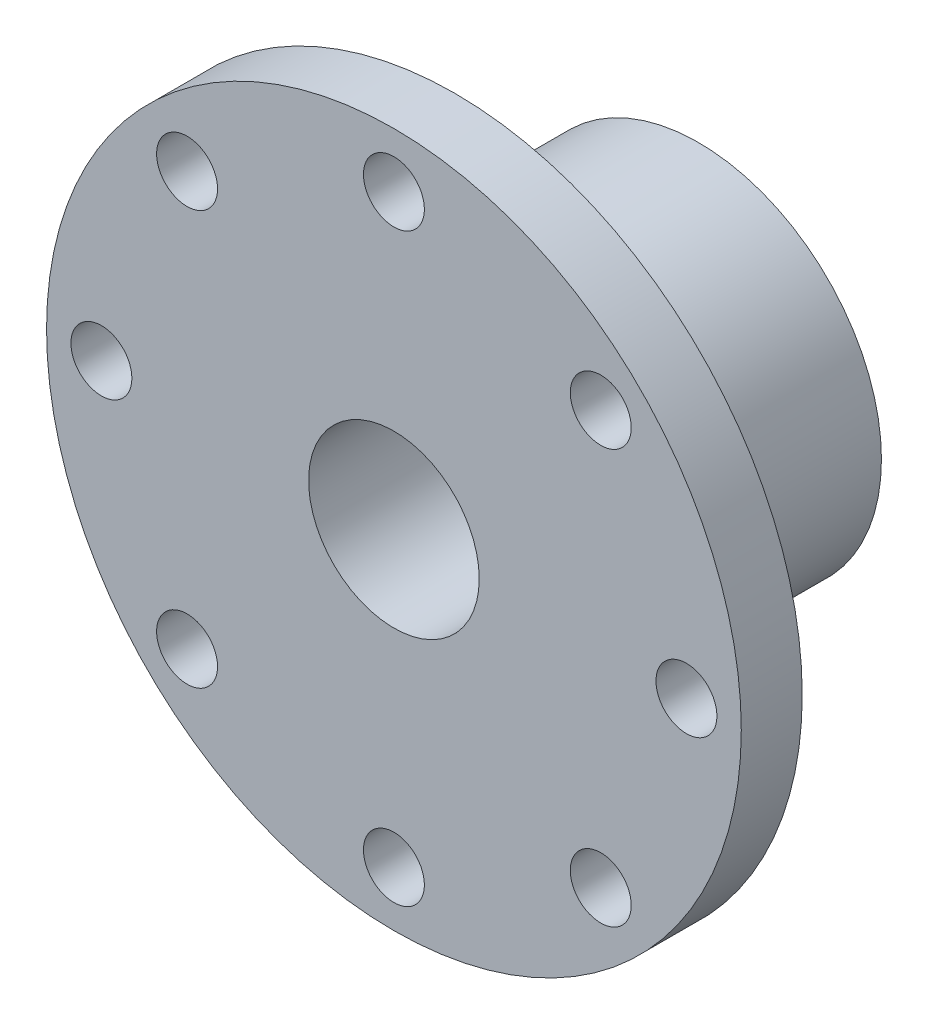
from build123d import *

# Parameters (mm, degrees)
SKETCH_1_R          = 15
SKETCH_1_R_2        = 7
EXTRUDE_1_DEPTH     = 20
SKETCH_2_R          = 28.5
SKETCH_2_R_2        = 7
EXTRUDE_2_DEPTH     = 5
SKETCH_3_R          = 2.5
CUT_EXTRUDE_1_DEPTH = 5
SKETCH_4_R          = 3
CUT_EXTRUDE_2_DEPTH = 20


with BuildPart() as part:
    # 草图1 → 凸台-拉伸1 (new body)
    with BuildSketch(Plane.XY):
        Circle(SKETCH_1_R)
        Circle(SKETCH_1_R_2, mode=Mode.SUBTRACT)
    extrude(amount=EXTRUDE_1_DEPTH)

    # 草图2 → 凸台-拉伸2 (add)
    with BuildSketch(Plane.XY.offset(20)):
        Circle(SKETCH_2_R)
        Circle(SKETCH_2_R_2, mode=Mode.SUBTRACT)
    extrude(amount=EXTRUDE_2_DEPTH)

    # 草图3 → 切除-拉伸1 (cut)
    with BuildSketch(Plane.XY.offset(25)):
        with Locations((0, -24)):
            Circle(SKETCH_3_R)
        with Locations((-16.970562748, -16.970562748)):
            Circle(SKETCH_3_R)
        with Locations((-24, 0)):
            Circle(SKETCH_3_R)
        with Locations((-16.970562748, 16.970562748)):
            Circle(SKETCH_3_R)
        with Locations((0, 24)):
            Circle(SKETCH_3_R)
        with Locations((16.970562748, 16.970562748)):
            Circle(SKETCH_3_R)
        with Locations((24, 0)):
            Circle(SKETCH_3_R)
        with Locations((16.970562748, -16.970562748)):
            Circle(SKETCH_3_R)
    extrude(amount=-CUT_EXTRUDE_1_DEPTH, mode=Mode.SUBTRACT)

    # 草图4 → 切除-拉伸2 (cut)
    with BuildSketch(Plane(origin=(0, 0, 0), x_dir=(1, 0, 0), z_dir=(0, 1, 0))):
        with Locations(Location((0, -10, 0), (0, 0, 270))):
            Circle(SKETCH_4_R)
    extrude(amount=-CUT_EXTRUDE_2_DEPTH, mode=Mode.SUBTRACT)


solid = part.part
